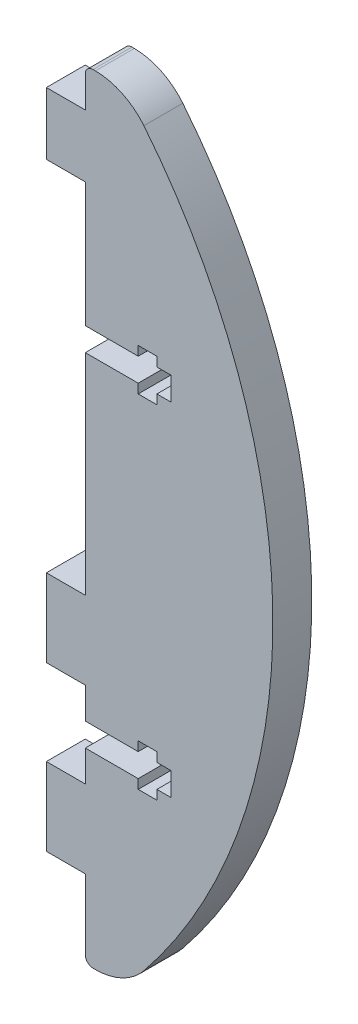
from build123d import *

# Parameters (mm, degrees)
RESSALTO_EXTRUS_O1_DEPTH = 5


with BuildPart() as part:
    # Model → Ressalto-extrusão1 (new body)
    with BuildSketch(Plane.XY):
        with BuildLine():
            Line((-182.000002727, 45.000001207), (-182.000002727, 54.000000805))
            Line((-182.000002727, 54.000000805), (-187.000002816, 54.000000805))
            Line((-187.000002816, 54.000000805), (-187.000002816, 64.000000954))
            Line((-187.000002816, 64.000000954), (-182.000002727, 64.000000954))
            Line((-182.000002727, 64.000000954), (-182.000002727, 68.000001045))
            Line((-182.000002727, 68.000001045), (-175.200002727, 68.000001045))
            Line((-175.200002727, 68.000001045), (-175.200002727, 66.800001045))
            Line((-175.200002727, 66.800001045), (-172.800002727, 66.800001045))
            Line((-172.800002727, 66.800001045), (-172.800002727, 68.000001045))
            Line((-172.800002727, 68.000001045), (-171.000002727, 68.000001045))
            Line((-171.000002727, 68.000001045), (-171.000002727, 71.000001026))
            Line((-171.000002727, 71.000001026), (-172.800002727, 71.000001026))
            Line((-172.800002727, 71.000001026), (-172.800002727, 72.200001026))
            Line((-172.800002727, 72.200001026), (-175.200002727, 72.200001026))
            Line((-175.200002727, 72.200001026), (-175.200002727, 71.000001026))
            Line((-175.200002727, 71.000001026), (-182.000002727, 71.000001026))
            Line((-182.000002727, 71.000001026), (-182.000002727, 75.000001118))
            Line((-182.000002727, 75.000001118), (-187.000002816, 75.000001118))
            Line((-187.000002816, 75.000001118), (-187.000002816, 85.000001267))
            Line((-187.000002816, 85.000001267), (-182.000002727, 85.000001267))
            Line((-182.000002727, 85.000001267), (-182.000002727, 112.000001058))
            Line((-182.000002727, 112.000001058), (-175.200002727, 112.000001058))
            Line((-175.200002727, 112.000001058), (-175.200002727, 110.800001058))
            Line((-175.200002727, 110.800001058), (-172.800002727, 110.800001058))
            Line((-172.800002727, 110.800001058), (-172.800002727, 112.000001058))
            Line((-172.800002727, 112.000001058), (-171.000002727, 112.000001058))
            Line((-171.000002727, 112.000001058), (-171.000002727, 115.00000104))
            Line((-171.000002727, 115.00000104), (-172.800002727, 115.00000104))
            Line((-172.800002727, 115.00000104), (-172.800002727, 116.20000104))
            Line((-172.800002727, 116.20000104), (-175.200002727, 116.20000104))
            Line((-175.200002727, 116.20000104), (-175.200002727, 115.00000104))
            Line((-175.200002727, 115.00000104), (-182.000002727, 115.00000104))
            Line((-182.000002727, 115.00000104), (-182.000002727, 131.000001952))
            Line((-182.000002727, 131.000001952), (-187.000002816, 131.000001952))
            Line((-187.000002816, 131.000001952), (-187.000002816, 139.000002071))
            Line((-187.000002816, 139.000002071), (-182.000002727, 139.000002071))
            Line((-182.000002727, 139.000002071), (-182.000002727, 143.000002162))
            ThreePointArc((-182.000002727, 143.000002162), (-181.707109508, 143.707108943), (-181.000002727, 144.000002162))
            Line((-181.000002727, 144.000002162), (-180.698724383, 144.000002162))
            ThreePointArc((-180.698724383, 144.000002162), (-177.250425834, 143.20301546), (-174.467200153, 141.016784571))
            ThreePointArc((-174.467200153, 141.016784571), (-157.893266413, 94.000001418), (-174.467200151, 46.983218264))
            ThreePointArc((-174.467200151, 46.983218264), (-177.245806987, 44.787339393), (-180.698724383, 44.000001207))
            Line((-180.698724383, 44.000001207), (-181.000002727, 44.000001207))
            ThreePointArc((-181.000002727, 44.000001207), (-181.707109508, 44.292894425), (-182.000002727, 45.000001207))
        make_face()
    extrude(amount=RESSALTO_EXTRUS_O1_DEPTH)


solid = part.part
